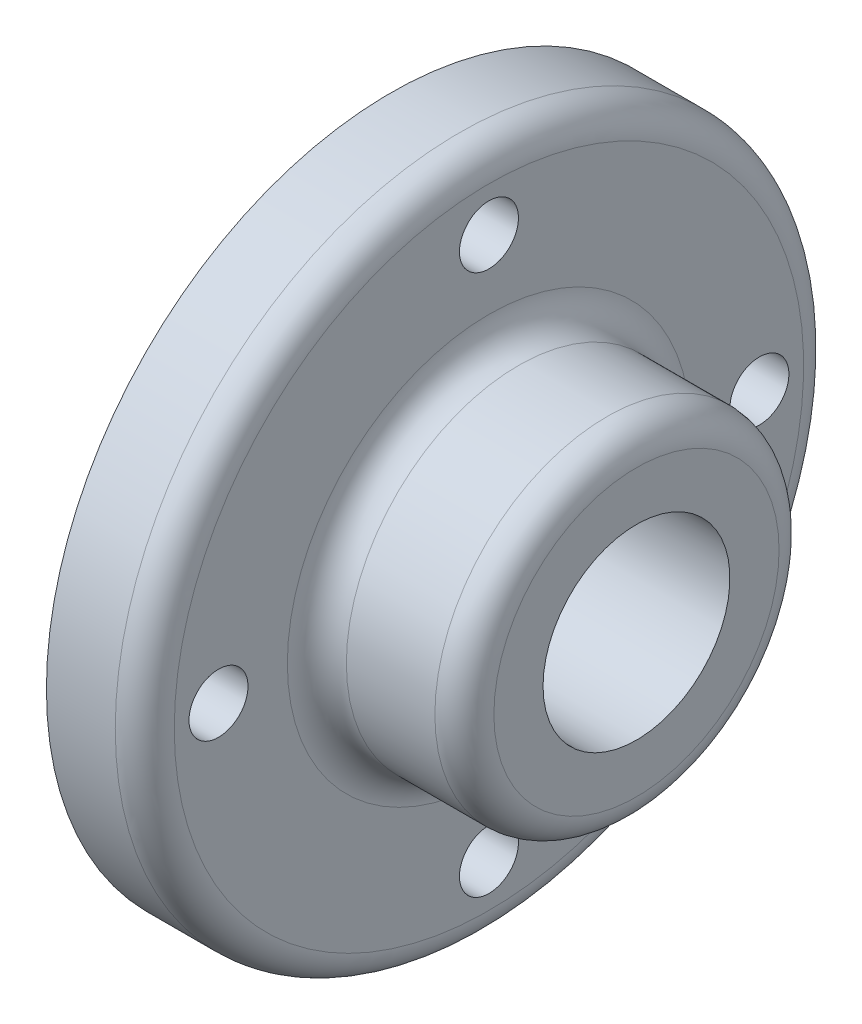
from build123d import *

# Parameters (mm, degrees)
FILLET1_R                  = 6
F_12_0_12_DIAMETER_HOLE1_D = 12
CIRPATTERN1_COUNT          = 4


with BuildPart() as part:
    # Sketch1 → Revolve1 (revolve)
    with BuildSketch(Plane.XY, mode=Mode.PRIVATE) as revolve1_sk:
        Polygon((0, 19), (0, 70), (20, 70), (20, 35), (50, 35), (50, 19), align=None)
    revolve(revolve1_sk.sketch.rotate(Axis((0, 0, 0), (1, 0, 0)), 90), axis=Axis((0, 0, 0), (1, 0, 0)))

    # Fillet1
    fillet1_edges = [part.edges().sort_by_distance(p)[0] for p in [
        (50, 0, -35),
        (20, 0, -35),
        (20, 0, -70),
    ]]
    fillet(fillet1_edges, radius=FILLET1_R)

    # Ø12.0 (12) Diameter Hole1 (through all)
    with Locations(Plane.ZY):
        with Locations((0, 55)):
            f_12_0_12_diameter_hole1 = Hole(F_12_0_12_DIAMETER_HOLE1_D / 2)

    # CirPattern1: Ø12.0 (12) Diameter Hole1 ×4 about axis
    cirpattern1_axis = Axis((0, 0, 0), (1, 0, 0))
    for i in range(1, CIRPATTERN1_COUNT):
        add(f_12_0_12_diameter_hole1.rotate(cirpattern1_axis, i * 360 / CIRPATTERN1_COUNT), mode=Mode.SUBTRACT)


solid = part.part
